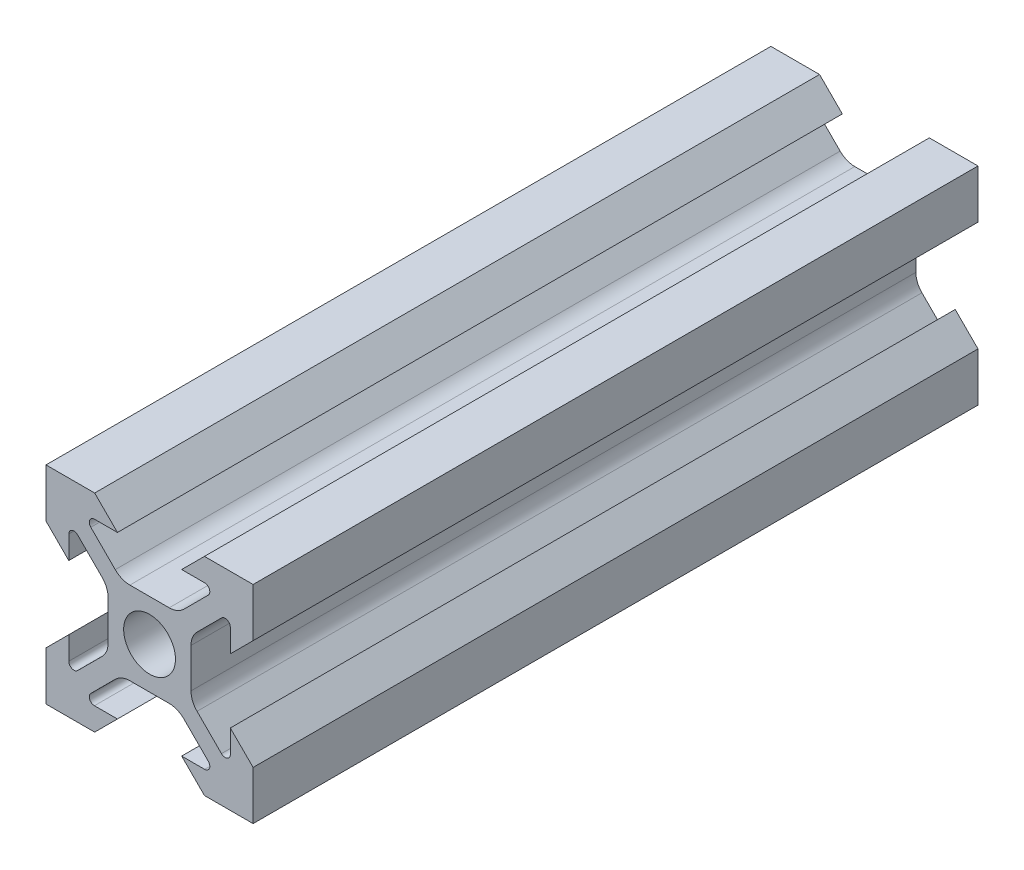
from build123d import *

# Parameters (mm, degrees)
SKETCH1_R           = 2.5
BOSS_EXTRUDE1_DEPTH = 70


with BuildPart() as part:
    # Sketch1 → Boss-Extrude1 (new body)
    with BuildSketch(Plane.XY):
        with BuildLine():
            Line((-10, 10), (-10, 5.3))
            Line((-10, 5.3), (-7.8, 3.1))
            Line((-7.8, 3.1), (-7.8, 5.320101013))
            ThreePointArc((-7.8, 5.320101013), (-7.491341716, 5.782040779), (-6.946446609, 5.673654403))
            Line((-6.946446609, 5.673654403), (-4.585786438, 3.312994231))
            ThreePointArc((-4.585786438, 3.312994231), (-4.152240935, 2.664147534), (-4, 1.898780669))
            Line((-4, 1.898780669), (-4, 0))
            Line((-4, 0), (-4, -1.898780669))
            ThreePointArc((-4, -1.898780669), (-4.152240935, -2.664147534), (-4.585786438, -3.312994231))
            Line((-4.585786438, -3.312994231), (-6.946446609, -5.673654403))
            ThreePointArc((-6.946446609, -5.673654403), (-7.491341716, -5.782040779), (-7.8, -5.320101013))
            Line((-7.8, -5.320101013), (-7.8, -3.1))
            Line((-7.8, -3.1), (-10, -5.3))
            Line((-10, -5.3), (-10, -10))
            Line((-10, -10), (-5.3, -10))
            Line((-5.3, -10), (-3.1, -7.8))
            Line((-3.1, -7.8), (-5.320101013, -7.8))
            ThreePointArc((-5.320101013, -7.8), (-5.782040779, -7.491341716), (-5.673654403, -6.946446609))
            Line((-5.673654403, -6.946446609), (-3.312994231, -4.585786438))
            ThreePointArc((-3.312994231, -4.585786438), (-2.664147534, -4.152240935), (-1.898780669, -4))
            Line((-1.898780669, -4), (0, -4))
            Line((0, -4), (1.898780669, -4))
            ThreePointArc((1.898780669, -4), (2.664147534, -4.152240935), (3.312994231, -4.585786438))
            Line((3.312994231, -4.585786438), (5.673654403, -6.946446609))
            ThreePointArc((5.673654403, -6.946446609), (5.782040779, -7.491341716), (5.320101013, -7.8))
            Line((5.320101013, -7.8), (3.1, -7.8))
            Line((3.1, -7.8), (5.3, -10))
            Line((5.3, -10), (10, -10))
            Line((10, -10), (10, -5.3))
            Line((10, -5.3), (7.8, -3.1))
            Line((7.8, -3.1), (7.8, -5.320101013))
            ThreePointArc((7.8, -5.320101013), (7.491341716, -5.782040779), (6.946446609, -5.673654403))
            Line((6.946446609, -5.673654403), (4.585786438, -3.312994231))
            ThreePointArc((4.585786438, -3.312994231), (4.152240935, -2.664147534), (4, -1.898780669))
            Line((4, -1.898780669), (4, 0))
            Line((4, 0), (4, 1.898780669))
            ThreePointArc((4, 1.898780669), (4.152240935, 2.664147534), (4.585786438, 3.312994231))
            Line((4.585786438, 3.312994231), (6.946446609, 5.673654403))
            ThreePointArc((6.946446609, 5.673654403), (7.491341716, 5.782040779), (7.8, 5.320101013))
            Line((7.8, 5.320101013), (7.8, 3.1))
            Line((7.8, 3.1), (10, 5.3))
            Line((10, 5.3), (10, 10))
            Line((10, 10), (5.3, 10))
            Line((5.3, 10), (3.1, 7.8))
            Line((3.1, 7.8), (5.320101013, 7.8))
            ThreePointArc((5.320101013, 7.8), (5.782040779, 7.491341716), (5.673654403, 6.946446609))
            Line((5.673654403, 6.946446609), (3.312994231, 4.585786438))
            ThreePointArc((3.312994231, 4.585786438), (2.664147534, 4.152240935), (1.898780669, 4))
            Line((1.898780669, 4), (0, 4))
            Line((0, 4), (-1.898780669, 4))
            ThreePointArc((-1.898780669, 4), (-2.664147534, 4.152240935), (-3.312994231, 4.585786438))
            Line((-3.312994231, 4.585786438), (-5.673654403, 6.946446609))
            ThreePointArc((-5.673654403, 6.946446609), (-5.782040779, 7.491341716), (-5.320101013, 7.8))
            Line((-5.320101013, 7.8), (-3.1, 7.8))
            Line((-3.1, 7.8), (-5.3, 10))
            Line((-5.3, 10), (-10, 10))
        make_face()
        Circle(SKETCH1_R, mode=Mode.SUBTRACT)
    extrude(amount=BOSS_EXTRUDE1_DEPTH)


solid = part.part
